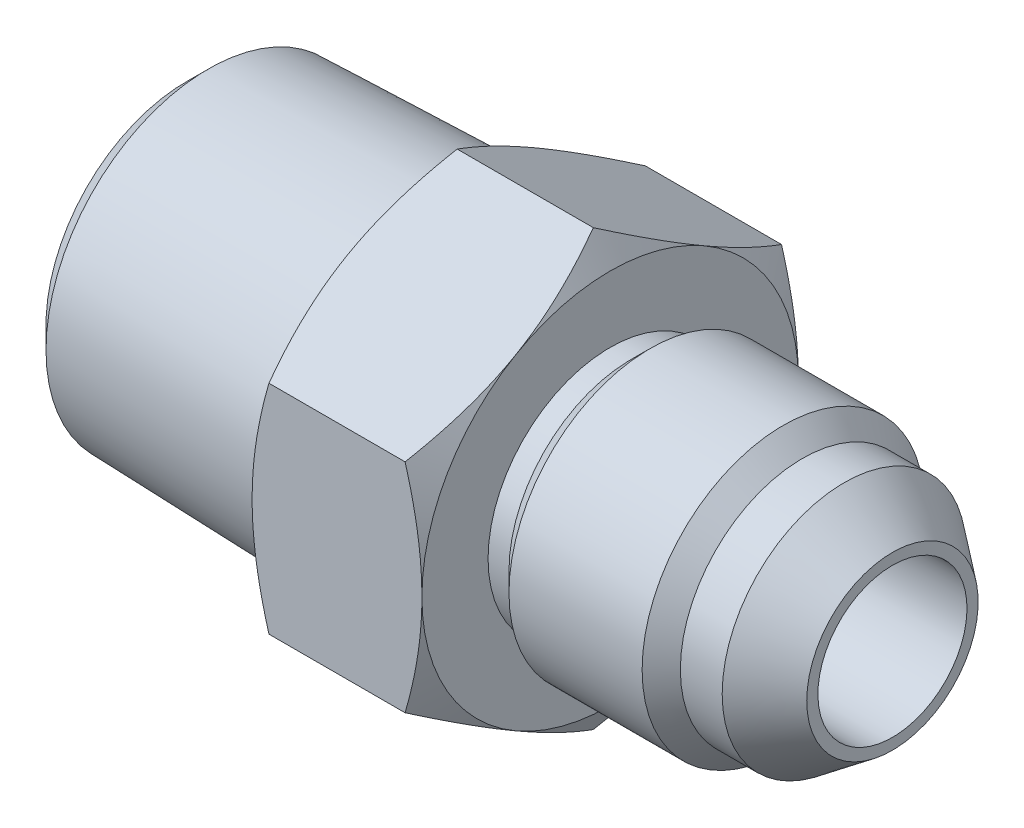
from build123d import *

# Parameters (mm, degrees)
SKETCH6_W           = 35.7124
SKETCH6_H           = 7.14375
EXTRUDE1_DEPTH      = 8.59028
SKETCH7_W           = 35.7124
SKETCH7_H           = 3.7719
SKETCH17_R          = 7.14375
CUT_EXTRUDE1_DEPTH  = 12.83462
SKETCH19_R          = 8.5725
BOSS_EXTRUDE1_DEPTH = 12.83462
BOSS_EXTRUDE1_DRAFT = -1.75
CHAMFER1_SIZE       = 1.058333333
CHAMFER1_SIZE2      = 1.092196811
SKETCH22_R          = 8.5725
BOSS_EXTRUDE3_DEPTH = 12.83462
BOSS_EXTRUDE3_DRAFT = -15
SKETCH23_R          = 6.36003356
CUT_EXTRUDE2_DEPTH  = 12.83462


with BuildPart() as part:
    # Sketch6 → Revolve3 (revolve)
    with BuildSketch(Plane.XY, mode=Mode.PRIVATE) as revolve3_sk:
        with Locations((0, 3.571875)):
            Rectangle(SKETCH6_W, SKETCH6_H)
    revolve(revolve3_sk.sketch.rotate(Axis((-17.8562, 0, 0), (1, 0, 0)), 90), axis=Axis((-17.8562, 0, 0), (1, 0, 0)))

    # Sketch12 → Extrude1 (add)
    with BuildSketch(Plane(origin=(-5.02158, 0, 0), x_dir=(0, 0, -1), z_dir=(1, 0, 0))):
        Polygon((0, 10.998522628), (-9.525, 5.499261314), (-9.525, -5.499261314), (0, -10.998522628), (9.525, -5.499261314), (9.525, 5.499261314), align=None)
    extrude(amount=EXTRUDE1_DEPTH)

    # Sketch10 → Cut-Revolve6 (revolve, cut)
    with BuildSketch(Plane.XY, mode=Mode.PRIVATE) as cut_revolve6_sk:
        Polygon((5.594376886, 7.14375), (3.5687, 7.14375), (3.5687, 6.176406448), (4.627033333, 6.176406448), align=None)
        Polygon((17.8562, 7.14375), (12.332124005, 7.14375), (13.299467558, 6.176406448), (15.416134224, 6.176406448), (17.8562, 4.337685), align=None)
    revolve(cut_revolve6_sk.sketch.rotate(Axis((-17.8562, 0, 0), (1, 0, 0)), 90), axis=Axis((-17.8562, 0, 0), (1, 0, 0)), mode=Mode.SUBTRACT)

    # Sketch7 → Cut-Revolve5 (revolve, cut)
    with BuildSketch(Plane.XY):
        with Locations((0, 1.88595)):
            Rectangle(SKETCH7_W, SKETCH7_H)
    revolve(axis=Axis((17.8562, 0, 0), (-1, 0, 0)), mode=Mode.SUBTRACT)

    # Sketch13 → Cut-Revolve7 (revolve, cut)
    with BuildSketch(Plane.XY):
        Polygon((-5.02158, 10.998522628), (-5.02158, 9.525), (-4.170841314, 10.998522628), align=None)
        Polygon((2.717961314, 10.998522628), (3.5687, 9.525), (3.5687, 10.998522628), align=None)
    revolve(axis=Axis((-17.8562, 0, 0), (1, 0, 0)), mode=Mode.SUBTRACT)

    # Sketch17 → Cut-Extrude1 (cut)
    with BuildSketch(Plane.ZY.offset(17.8562)):
        Circle(SKETCH17_R)
    extrude(amount=-CUT_EXTRUDE1_DEPTH, mode=Mode.SUBTRACT)


with BuildPart() as body_2:
    # Sketch19 → Boss-Extrude1 (with draft: the straight prism first)
    with BuildSketch(Plane(origin=(-5.02158, 0, 0), x_dir=(0, 0, -1), z_dir=(1, 0, 0))):
        Circle(SKETCH19_R)
    extrude(amount=-BOSS_EXTRUDE1_DEPTH)
    # Boss-Extrude1: the draft: its side faces are tilted about the plane it starts from
    boss_extrude1_sides = [body_2.faces().sort_by_distance(p)[0] for p in [
        (-11.43889, 0, 8.5725),
    ]]
    draft(boss_extrude1_sides, Plane(origin=(-5.02158, 0, 0), x_dir=(0, 0, -1), z_dir=(1, 0, 0)), BOSS_EXTRUDE1_DRAFT)

    # Chamfer1
    chamfer1_edges = [body_2.edges().sort_by_distance(p)[0] for p in [
        (-17.8562, 0, 8.180366893),
    ]]
    chamfer1_side = [body_2.faces().sort_by_distance(p)[0] for p in [
        (-17.8562, 0, 0),
    ]]
    chamfer(chamfer1_edges, length=CHAMFER1_SIZE, length2=CHAMFER1_SIZE2, reference=chamfer1_side[0])


with BuildPart() as boss_extrude3_tool:
    # Sketch22 → Boss-Extrude3 (with draft: the straight prism first)
    with BuildSketch(Plane(origin=(-5.02158, 0, 0), x_dir=(0, 0, -1), z_dir=(1, 0, 0))):
        Circle(SKETCH22_R)
    extrude(amount=-BOSS_EXTRUDE3_DEPTH)
    # Boss-Extrude3: the draft: its side faces are tilted about the plane it starts from
    boss_extrude3_sides = [boss_extrude3_tool.faces().sort_by_distance(p)[0] for p in [
        (-11.43889, 0, 8.5725),
    ]]
    draft(boss_extrude3_sides, Plane(origin=(-5.02158, 0, 0), x_dir=(0, 0, -1), z_dir=(1, 0, 0)), BOSS_EXTRUDE3_DRAFT)


with BuildPart() as body_2_1:
    add(body_2.part)

    # Boss-Extrude3: add boss_extrude3_tool
    add(boss_extrude3_tool.part)

    # Combine1: union part
    add(part.part)

    # Sketch23 → Cut-Extrude2 (cut)
    with BuildSketch(Plane.ZY.offset(17.8562)):
        Circle(SKETCH23_R)
    extrude(amount=-CUT_EXTRUDE2_DEPTH, mode=Mode.SUBTRACT)


solid = body_2_1.part
